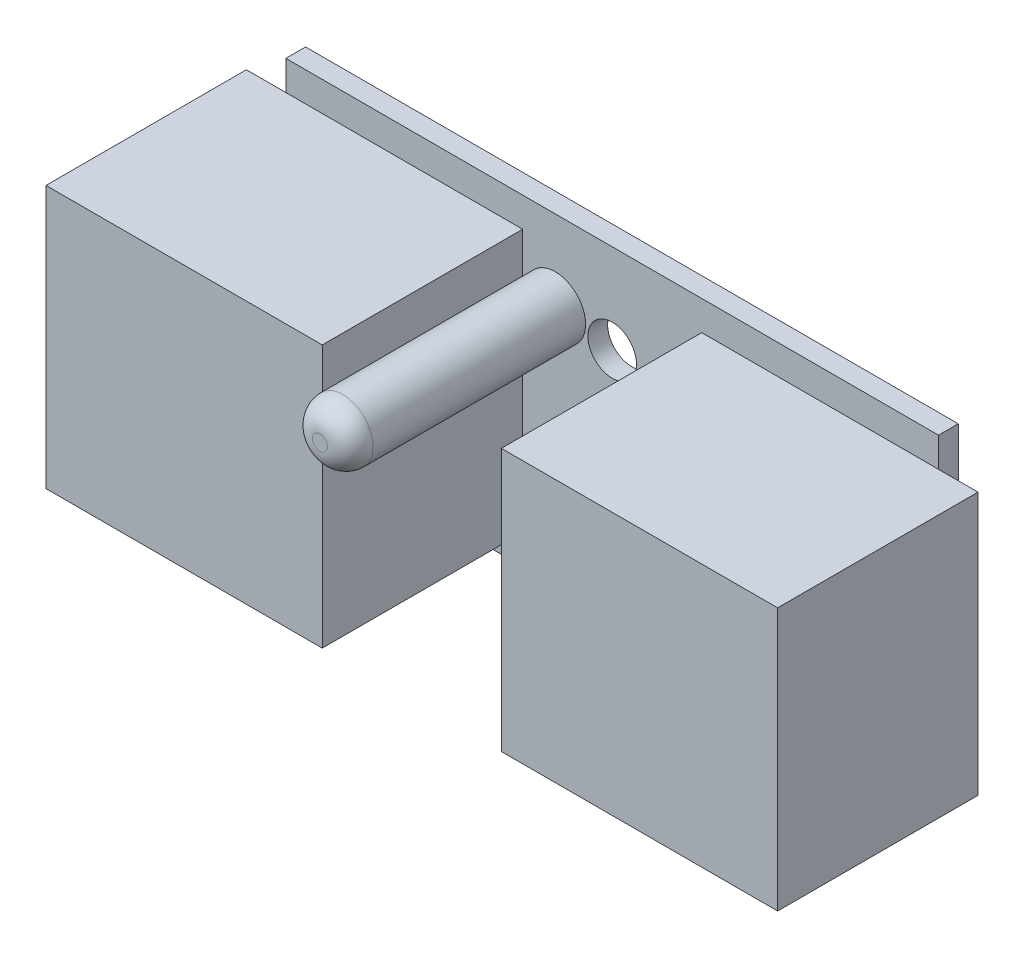
from build123d import *

# Parameters (mm, degrees)
SKETCH1_W           = 43
SKETCH1_H           = 21.2
SKETCH1_R           = 1.6
BOSS_EXTRUDE1_DEPTH = 1.3
SKETCH2_R           = 2
BOSS_EXTRUDE2_DEPTH = 15.5
FILLET1_R           = 1.5
SKETCH3_W           = 18.2
SKETCH3_H           = 17.3
BOSS_EXTRUDE3_DEPTH = 13.2


with BuildPart() as part:
    # Sketch1 → Boss-Extrude1 (new body)
    with BuildSketch(Plane.XY):
        with Locations((21.5, 10.6)):
            Rectangle(SKETCH1_W, SKETCH1_H)
        with Locations((21.5, 15.3)):
            Circle(SKETCH1_R, mode=Mode.SUBTRACT)
    extrude(amount=BOSS_EXTRUDE1_DEPTH)

    # Sketch2 → Boss-Extrude2 (add)
    with BuildSketch(Plane.XY.offset(1.3)):
        with Locations(Location((17.75, 15.9, 0), (0, 0, 180))):
            Circle(SKETCH2_R)
    extrude(amount=BOSS_EXTRUDE2_DEPTH)

    # Fillet1
    fillet1_edges = [part.edges().sort_by_distance(p)[0] for p in [
        (19.75, 15.9, 16.8),
    ]]
    fillet(fillet1_edges, radius=FILLET1_R)

    # Sketch3 → Boss-Extrude3 (add)
    with BuildSketch(Plane.XY.offset(1.3)):
        with Locations((36.5, 10.6)):
            Rectangle(SKETCH3_W, SKETCH3_H)
        with Locations((6.5, 10.6)):
            Rectangle(SKETCH3_W, SKETCH3_H)
    extrude(amount=BOSS_EXTRUDE3_DEPTH)


solid = part.part
